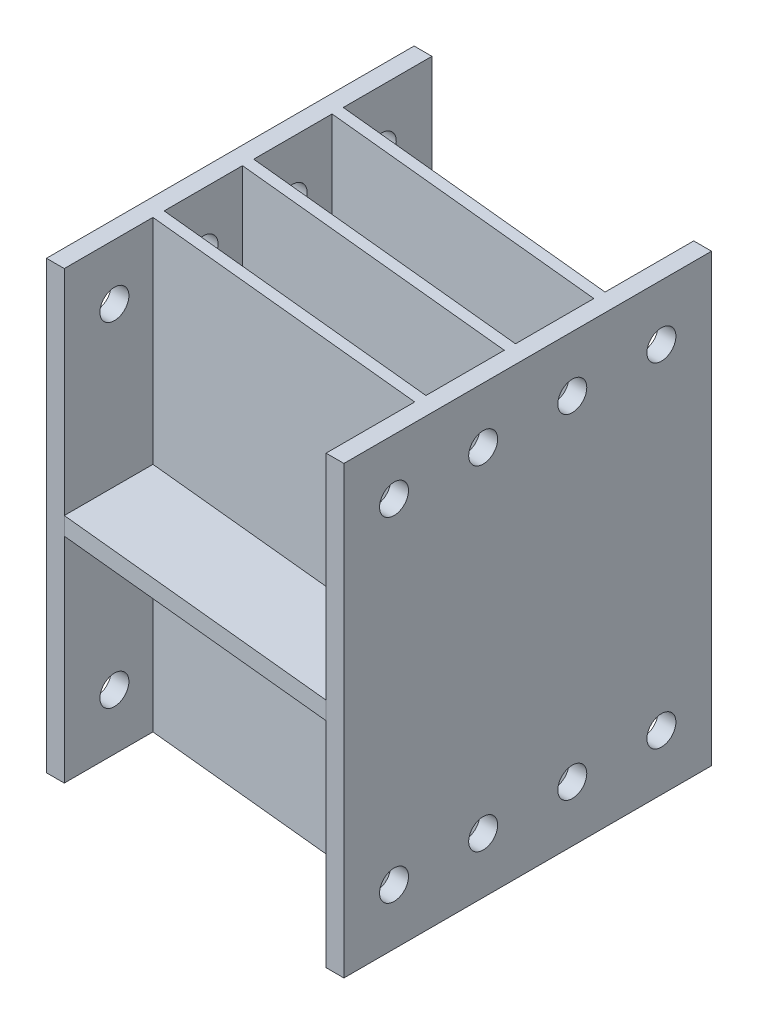
from build123d import *

# Parameters (mm, degrees)
SKETCH_7_W                  = 400
SKETCH_7_H                  = 330
EXTRUDE_6_DEPTH             = 16
SKETCH_8_R                  = 13
CUT_EXTRUDE_2_DEPTH         = 519.802467226
PATTERN_LINEAR_1_COUNT      = 2
PATTERN_LINEAR_1_PITCH      = 300
PATTERN_LINEAR_1_COUNT_DIR2 = 4
PATTERN_LINEAR_1_PITCH_DIR2 = 80
SKETCH_9_W                  = 382
SKETCH_9_H                  = 16
EXTRUDE_7_DEPTH             = 261
CUT_EXTRUDE_3_DEPTH         = 497.718229986
EXTRUDE_8_DEPTH             = 192
EXTRUDE_9_DEPTH             = 192
SKETCH_13_W                 = 330
SKETCH_13_H                 = 400
EXTRUDE_10_DEPTH            = 16
SKETCH_14_R                 = 13
CUT_EXTRUDE_4_DEPTH         = 16
PATTERN_LINEAR_2_COUNT      = 4
PATTERN_LINEAR_2_PITCH      = 80
PATTERN_LINEAR_2_COUNT_DIR2 = 2
PATTERN_LINEAR_2_PITCH_DIR2 = 300


with BuildPart() as part:
    # 草图7 → 凸台-拉伸6 (new body)
    with BuildSketch(Plane(origin=(0, 0, 0), x_dir=(0, -1, 0), z_dir=(1, 0, 0))):
        with Locations((200, 165)):
            Rectangle(SKETCH_7_W, SKETCH_7_H)
    extrude(amount=EXTRUDE_6_DEPTH)

    # 草图8 → 切除-拉伸2 (cut, through all)
    with BuildSketch(Plane(origin=(16, 0, 0), x_dir=(0, -1, 0), z_dir=(1, 0, 0))):
        with Locations(Location((50, 45, 0), (0, 0, 180))):
            Circle(SKETCH_8_R)
    cut_extrude_2 = extrude(amount=-CUT_EXTRUDE_2_DEPTH, mode=Mode.SUBTRACT)

    # 阵列(线性)1: Cut-Extrude 2 2 × 4
    with Locations(*[(0, -i * PATTERN_LINEAR_1_PITCH, -j * PATTERN_LINEAR_1_PITCH_DIR2) for i in range(PATTERN_LINEAR_1_COUNT) for j in range(PATTERN_LINEAR_1_COUNT_DIR2) if (i, j) != (0, 0)]):
        add(cut_extrude_2, mode=Mode.SUBTRACT)

    # 草图9 → 凸台-拉伸7 (add)
    with BuildSketch(Plane(origin=(16, 0, 0), x_dir=(0, 0, -1), z_dir=(1, 0, 0))):
        with Locations((165, -200)):
            Rectangle(SKETCH_9_W, SKETCH_9_H)
    extrude(amount=EXTRUDE_7_DEPTH)

    # 草图10 → 切除-拉伸3 (cut, through all)
    with BuildSketch(Plane(origin=(0, -208, 0), x_dir=(-1, 0, 0), z_dir=(0, -1, 0))):
        Polygon((-16, -26), (-16, 0), (-277, -26), align=None)
        Polygon((-16, 330), (-277, 304), (-277, 356), (-16, 356), align=None)
    extrude(amount=-CUT_EXTRUDE_3_DEPTH, mode=Mode.SUBTRACT)

    # 草图11 → 凸台-拉伸8 (add)
    with BuildSketch(Plane.XZ.offset(208)):
        Polygon((16, -79.579291616), (277, -53.579291616), (277, -63.62878672), (16, -89.62878672), align=None)
        Polygon((16, -170.024747552), (277, -144.024747552), (277, -133.975252448), (16, -159.975252448), align=None)
        Polygon((16, -240.37121328), (277, -214.37121328), (277, -224.420708384), (16, -250.420708384), align=None)
    extrude(amount=EXTRUDE_8_DEPTH)

    # 草图12 → 凸台-拉伸9 (add)
    with BuildSketch(Plane(origin=(0, -192, 0), x_dir=(1, 0, 0), z_dir=(0, 1, 0))):
        Polygon((16, 79.579291616), (16, 89.62878672), (277, 63.62878672), (277, 53.579291616), align=None)
        Polygon((16, 159.975252448), (16, 170.024747552), (277, 144.024747552), (277, 133.975252448), align=None)
        Polygon((16, 240.37121328), (16, 250.420708384), (277, 224.420708384), (277, 214.37121328), align=None)
    extrude(amount=EXTRUDE_9_DEPTH)

    # 草图13 → 凸台-拉伸10 (add)
    with BuildSketch(Plane(origin=(277, 0, 0), x_dir=(0, 0, -1), z_dir=(1, 0, 0))):
        with Locations((139, -200)):
            Rectangle(SKETCH_13_W, SKETCH_13_H)
    extrude(amount=EXTRUDE_10_DEPTH)

    # 草图14 → 切除-拉伸4 (cut)
    with BuildSketch(Plane(origin=(293, 0, 0), x_dir=(0, 0, -1), z_dir=(1, 0, 0))):
        with Locations((19, -350)):
            Circle(SKETCH_14_R)
    cut_extrude_4 = extrude(amount=-CUT_EXTRUDE_4_DEPTH, mode=Mode.SUBTRACT)

    # 阵列(线性)2: Cut-Extrude 4 4 × 2
    with Locations(*[(0, j * PATTERN_LINEAR_2_PITCH_DIR2, -i * PATTERN_LINEAR_2_PITCH) for i in range(PATTERN_LINEAR_2_COUNT) for j in range(PATTERN_LINEAR_2_COUNT_DIR2) if (i, j) != (0, 0)]):
        add(cut_extrude_4, mode=Mode.SUBTRACT)


solid = part.part
